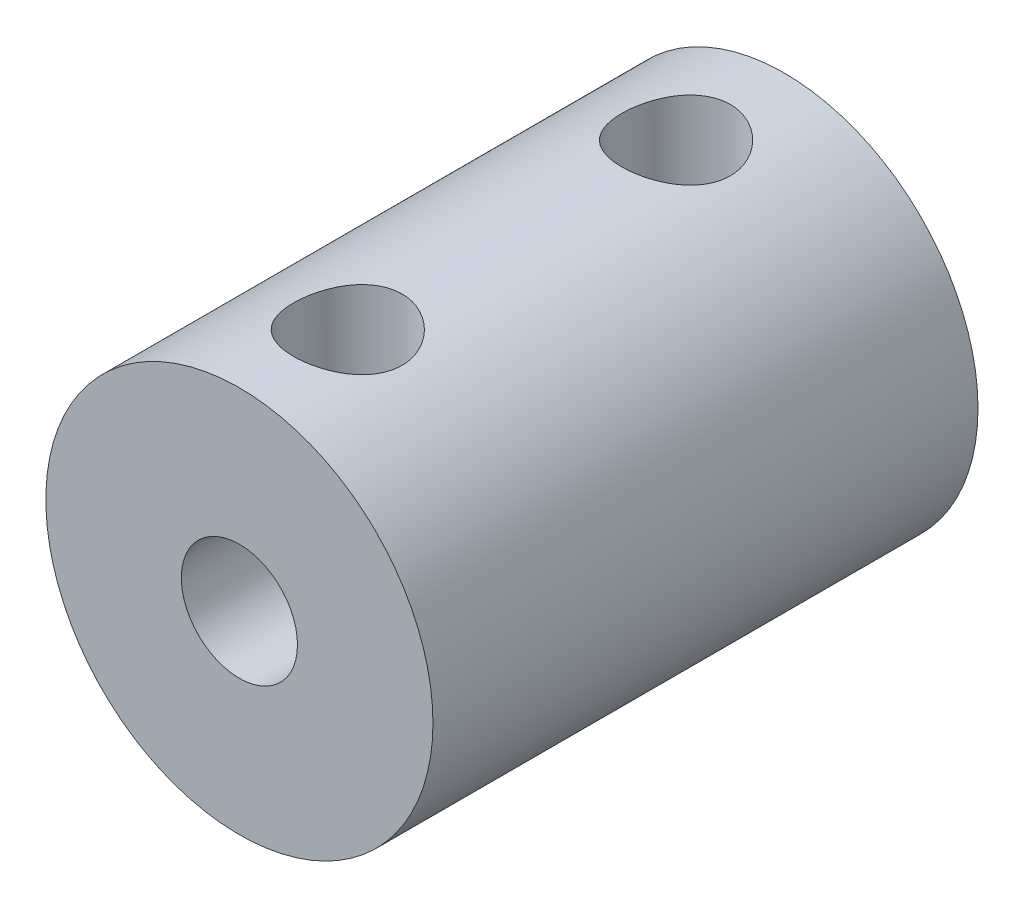
from build123d import *

# Parameters (mm, degrees)
SKETCH1_R           = 7.9375
BOSS_EXTRUDE1_DEPTH = 22.352
SKETCH2_R           = 2.38125
CUT_EXTRUDE1_DEPTH  = 26.012391259
SKETCH3_R           = 2.2225
CUT_EXTRUDE2_DEPTH  = 26.012391259


with BuildPart() as part:
    # Sketch1 → Boss-Extrude1 (new body)
    with BuildSketch(Plane.XY):
        Circle(SKETCH1_R)
    extrude(amount=BOSS_EXTRUDE1_DEPTH)

    # Sketch2 → Cut-Extrude1 (cut, through all)
    with BuildSketch(Plane.XY.offset(22.352)):
        Circle(SKETCH2_R)
    extrude(amount=-CUT_EXTRUDE1_DEPTH, mode=Mode.SUBTRACT)

    # Sketch3 → Cut-Extrude2 (cut, through all)
    with BuildSketch(Plane(origin=(0, 0, 0), x_dir=(1, 0, 0), z_dir=(0, 1, 0))):
        with Locations(Location((0, -4.445, 0), (0, 0, 90))):
            Circle(SKETCH3_R)
        with Locations(Location((0, -17.907, 0), (0, 0, 90))):
            Circle(SKETCH3_R)
    extrude(amount=CUT_EXTRUDE2_DEPTH, mode=Mode.SUBTRACT)


solid = part.part
